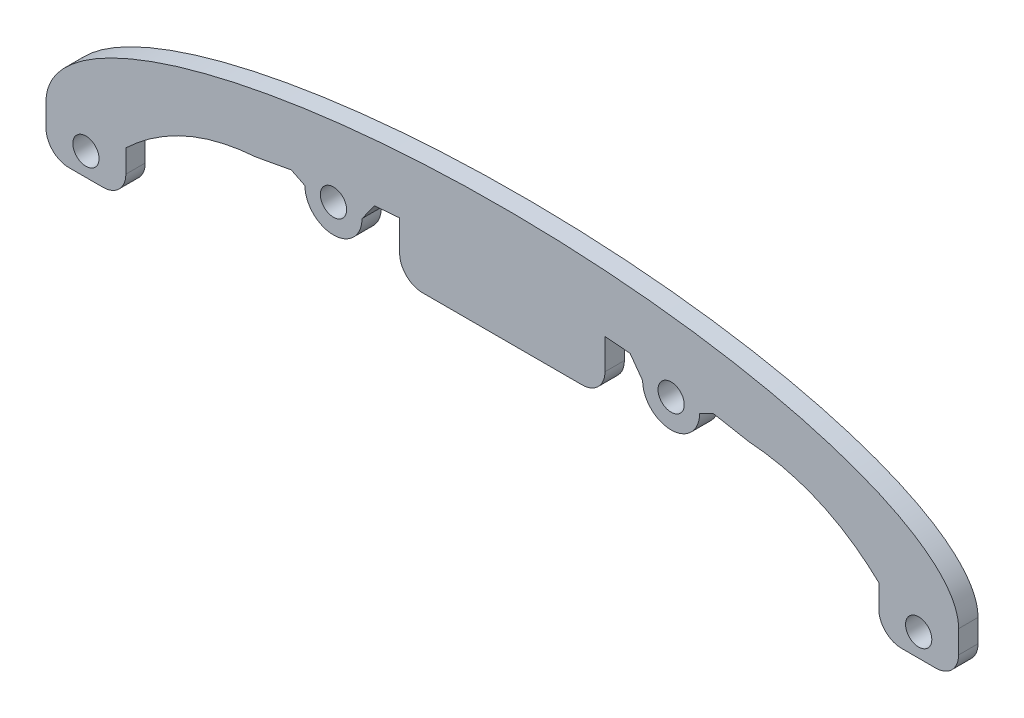
from build123d import *

# Parameters (mm, degrees)
DODANIE_WYCI_GNI_CIE1_DEPTH = 1.7
SZKIC2_R                    = 1.15
WYTNIJ_WYCI_GNI_CIE1_DEPTH  = 42.795813316
ZAOKR_GLENIE1_R             = 2


with BuildPart() as part:
    # Szkic1 → Dodanie-wyciągnięcie1 (new body)
    with BuildSketch(Plane.XY):
        with BuildLine():
            add(Edge.make_bspline(
                [(-11.2, 6.500052475), (-11.381613586, 6.483457098), (-13.27088078, 6.306197689), (-15.626961668, 6.023025368), (-17.806202115, 5.688838486), (-18.396244777, 5.592306202), (-18.5, 5.575141027)],
                knots=[-1.27513266, -1.27513266, -1.27513266, -1.27513266, -1.260264789, -1.120073741, -1.07622002, -1.066829966, -1.066829966, -1.066829966, -1.066829966], degree=3))
            add(Edge.make_bspline(
                [(-9, 6.679816), (-9.184930932, 6.666462992), (-9.554055689, 6.638937643), (-10.105390687, 6.595203086), (-10.654237972, 6.549036212), (-11.018386414, 6.516647851), (-11.2, 6.500052475)],
                knots=[-1.334604143, -1.334604143, -1.334604143, -1.334604143, -1.319736272, -1.304868401, -1.290000531, -1.27513266, -1.27513266, -1.27513266, -1.27513266], degree=3))
            add(Edge.make_bspline(
                [(9, 6.679816), (8.815069068, 6.693169007), (7.743850748, 6.767994599), (4.768476681, 6.935815197), (0, 7.043570361), (-4.768476681, 6.935815197), (-7.743850748, 6.767994599), (-8.815069068, 6.693169007), (-9, 6.679816)],
                knots=[-1.80698851, -1.80698851, -1.80698851, -1.80698851, -1.79212064, -1.721037189, -1.570796327, -1.420555465, -1.349472014, -1.334604143, -1.334604143, -1.334604143, -1.334604143], degree=3))
            add(Edge.make_bspline(
                [(11.2, 6.500052475), (11.018386414, 6.516647851), (10.654237972, 6.549036212), (10.105390687, 6.595203086), (9.554055689, 6.638937643), (9.184930932, 6.666462992), (9, 6.679816)],
                knots=[-1.866459994, -1.866459994, -1.866459994, -1.866459994, -1.851592123, -1.836724252, -1.821856381, -1.80698851, -1.80698851, -1.80698851, -1.80698851], degree=3))
            add(Edge.make_bspline(
                [(18.5, 5.575141027), (18.396244777, 5.592306202), (17.806202115, 5.688838486), (15.626961668, 6.023025368), (13.27088078, 6.306197689), (11.381613586, 6.483457098), (11.2, 6.500052475)],
                knots=[-2.074762688, -2.074762688, -2.074762688, -2.074762688, -2.065372634, -2.021518913, -1.881327865, -1.866459994, -1.866459994, -1.866459994, -1.866459994], degree=3))
            add(Edge.make_bspline(
                [(21.610248783, 5), (21.218014803, 5.080669051), (20.439497964, 5.234369435), (19.495106089, 5.4060474), (18.844771511, 5.517656987), (18.603755223, 5.557975852), (18.5, 5.575141027)],
                knots=[-2.171759775, -2.171759775, -2.171759775, -2.171759775, -2.134199559, -2.096639344, -2.084152741, -2.074762688, -2.074762688, -2.074762688, -2.074762688], degree=3))
            add(Edge.make_bspline(
                [(21.610248783, 5), (28.203420875, 4.53862996), (33, 0)],
                knots=[0, 0, 0, 1, 1, 1], degree=2))
            Line((33, 0), (33, -4))
            Line((33, -4), (40, -4))
            Line((40, -4), (40, 0))
            add(Edge.make_bspline(
                [(40, 0), (40, 12), (0, 12), (-40, 12), (-40, 0)],
                knots=[3.141592654, 3.141592654, 3.141592654, 4.71238898, 4.71238898, 6.283185307, 6.283185307, 6.283185307], degree=2, weights=[1, 0.707106781, 1, 0.707106781, 1]))
            Line((-40, 0), (-40, -4))
            Line((-40, -4), (-33, -4))
            Line((-33, -4), (-33, 0))
            add(Edge.make_bspline(
                [(-21.610248783, 5), (-28.203420875, 4.53862996), (-33, 0)],
                knots=[0, 0, 0, 1, 1, 1], degree=2))
            add(Edge.make_bspline(
                [(-18.5, 5.575141027), (-18.603755223, 5.557975852), (-18.844771511, 5.517656987), (-19.495106089, 5.4060474), (-20.439497964, 5.234369435), (-21.218014803, 5.080669051), (-21.610248783, 5)],
                knots=[-1.066829966, -1.066829966, -1.066829966, -1.066829966, -1.057439912, -1.04495331, -1.007393094, -0.969832879, -0.969832879, -0.969832879, -0.969832879], degree=3))
        make_face()
        with BuildLine():
            ThreePointArc((-17.3, 4.979816), (-14.8, 2.479816), (-12.3, 4.979816))
            Line((-12.3, 4.979816), (-11.2, 6.500052475))
            add(Edge.make_bspline(
                [(-11.2, 6.500052475), (-11.381613586, 6.483457098), (-13.27088078, 6.306197689), (-15.626961668, 6.023025368), (-17.806202115, 5.688838486), (-18.396244777, 5.592306202), (-18.5, 5.575141027)],
                knots=[-1.27513266, -1.27513266, -1.27513266, -1.27513266, -1.260264789, -1.120073741, -1.07622002, -1.066829966, -1.066829966, -1.066829966, -1.066829966], degree=3))
            Line((-18.5, 5.575141027), (-17.3, 4.979816))
        make_face()
        with BuildLine():
            add(Edge.make_bspline(
                [(9, 6.679816), (8.815069068, 6.693169007), (7.743850748, 6.767994599), (4.768476681, 6.935815197), (0, 7.043570361), (-4.768476681, 6.935815197), (-7.743850748, 6.767994599), (-8.815069068, 6.693169007), (-9, 6.679816)],
                knots=[-1.80698851, -1.80698851, -1.80698851, -1.80698851, -1.79212064, -1.721037189, -1.570796327, -1.420555465, -1.349472014, -1.334604143, -1.334604143, -1.334604143, -1.334604143], degree=3))
            Line((-9, 6.679816), (-9, 2))
            Line((-9, 2), (9, 2))
            Line((9, 2), (9, 6.679816))
        make_face()
        with BuildLine():
            add(Edge.make_bspline(
                [(18.5, 5.575141027), (18.396244777, 5.592306202), (17.806202115, 5.688838486), (15.626961668, 6.023025368), (13.27088078, 6.306197689), (11.381613586, 6.483457098), (11.2, 6.500052475)],
                knots=[-2.074762688, -2.074762688, -2.074762688, -2.074762688, -2.065372634, -2.021518913, -1.881327865, -1.866459994, -1.866459994, -1.866459994, -1.866459994], degree=3))
            Line((11.2, 6.500052475), (12.3, 4.979816))
            ThreePointArc((12.3, 4.979816), (14.8, 2.479816), (17.3, 4.979816))
            Line((17.3, 4.979816), (18.5, 5.575141027))
        make_face()
    extrude(amount=DODANIE_WYCI_GNI_CIE1_DEPTH)

    # Szkic2 → Wytnij-wyciągnięcie1 (cut, through all)
    with BuildSketch(Plane.XY.offset(1.7)):
        with Locations((-14.8, 4.979816)):
            Circle(SZKIC2_R)
        with Locations((14.8, 4.979816)):
            Circle(SZKIC2_R)
        with Locations((-36.5, -2)):
            Circle(SZKIC2_R)
        with Locations((36.5, -2)):
            Circle(SZKIC2_R)
    extrude(amount=-WYTNIJ_WYCI_GNI_CIE1_DEPTH, mode=Mode.SUBTRACT)

    # Zaokrąglenie1
    zaokr_glenie1_edges = [part.edges().sort_by_distance(p)[0] for p in [
        (9, 2, 0.85),
        (-9, 2, 0.85),
        (-33, -4, 0.85),
        (-40, -4, 0.85),
        (40, -4, 0.85),
        (33, -4, 0.85),
    ]]
    fillet(zaokr_glenie1_edges, radius=ZAOKR_GLENIE1_R)


solid = part.part
